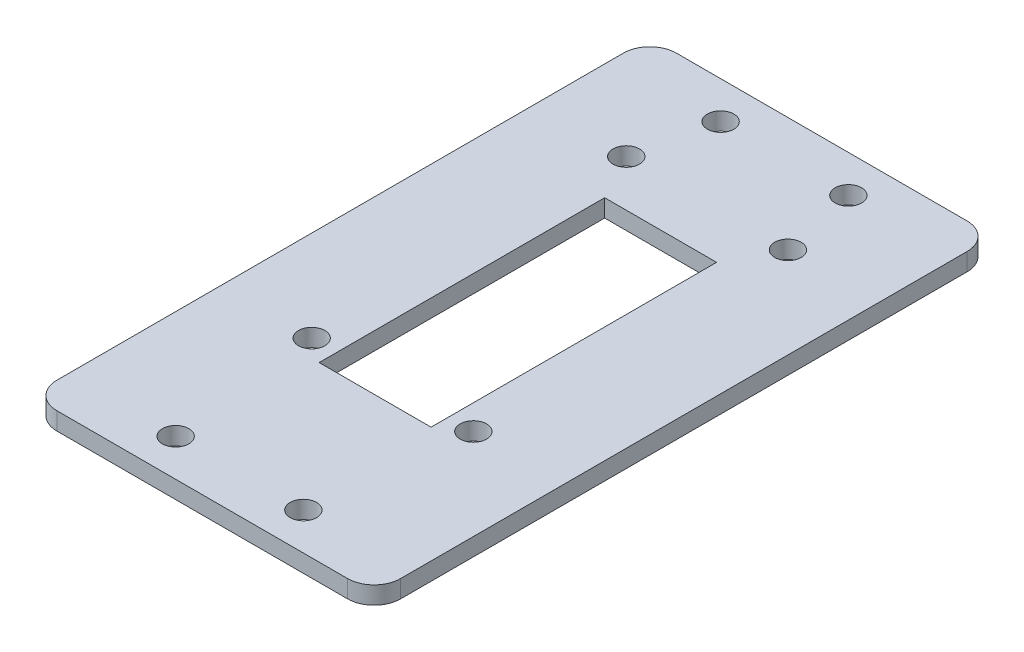
from build123d import *

# Parameters (mm, degrees)
SKETCH3_W           = 39
SKETCH3_H           = 70.3
SKETCH3_R           = 1.5
SKETCH3_W_2         = 12.7
SKETCH3_H_2         = 32.4
BOSS_EXTRUDE1_DEPTH = 2
FILLET1_R           = 3


with BuildPart() as part:
    # Sketch3 → Boss-Extrude1 (new body)
    with BuildSketch(Plane(origin=(0, 0, 0), x_dir=(1, 0, 0), z_dir=(0, 1, 0))):
        with Locations((0, 4.534618943)):
            Rectangle(SKETCH3_W, SKETCH3_H)
        with Locations(Location((-7.25, 35.459618943, 0), (0, 0, 270))):
            Circle(SKETCH3_R, mode=Mode.SUBTRACT)
        with Locations(Location((7.25, 35.459618943, 0), (0, 0, 270))):
            Circle(SKETCH3_R, mode=Mode.SUBTRACT)
        with Locations(Location((7.25, -26.390381057, 0), (0, 0, 270))):
            Circle(SKETCH3_R, mode=Mode.SUBTRACT)
        with Locations(Location((-7.25, -26.390381057, 0), (0, 0, 270))):
            Circle(SKETCH3_R, mode=Mode.SUBTRACT)
        with Locations(Location((9.175, 26.675, 0), (0, 0, 270))):
            Circle(SKETCH3_R, mode=Mode.SUBTRACT)
        with Locations(Location((9.175, -9.025, 0), (0, 0, 270))):
            Circle(SKETCH3_R, mode=Mode.SUBTRACT)
        with Locations(Location((-9.175, 26.675, 0), (0, 0, 270))):
            Circle(SKETCH3_R, mode=Mode.SUBTRACT)
        with Locations(Location((-9.175, -9.025, 0), (0, 0, 270))):
            Circle(SKETCH3_R, mode=Mode.SUBTRACT)
        with Locations((0, 5.2)):
            Rectangle(SKETCH3_W_2, SKETCH3_H_2, mode=Mode.SUBTRACT)
    extrude(amount=-BOSS_EXTRUDE1_DEPTH)

    # Fillet1
    fillet1_edges = [part.edges().sort_by_distance(p)[0] for p in [
        (-19.5, -1, -39.684618943),
        (19.5, -1, -39.684618943),
        (19.5, -1, 30.615381057),
        (-19.5, -1, 30.615381057),
    ]]
    fillet(fillet1_edges, radius=FILLET1_R)


solid = part.part
